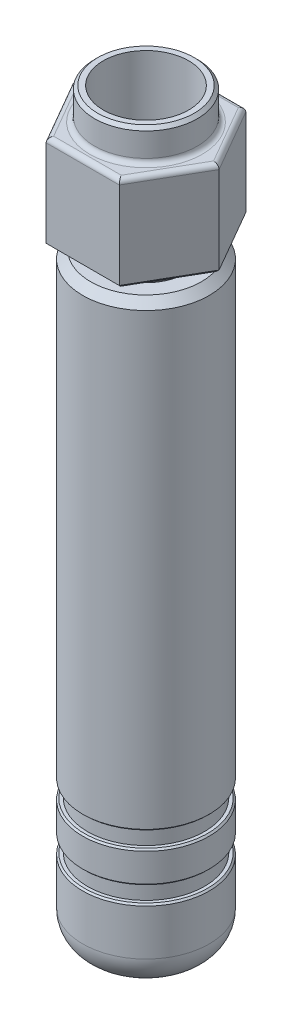
from build123d import *

# Parameters (mm, degrees)
SKETCH_1_R          = 2.85
EXTRUDE_1_DEPTH     = 1
EXTRUDE_2_DEPTH     = 6
SKETCH_3_R          = 3.25
EXTRUDE_3_DEPTH     = 2
CHAMFER_3_SIZE      = 0.2
FILLET_2_R          = 0.3
CHAMFER_4_SIZE      = 0.2
CHAMFER_5_SIZE      = 0.3
SKETCH_5_R          = 2.7
CUT_EXTRUDE_1_DEPTH = 5
SKETCH_6_R          = 4
EXTRUDE_4_DEPTH     = 38
FILLET_3_R          = 2
CHAMFER_6_SIZE      = 0.5
SKETCH_7_W          = 4
SKETCH_7_H          = 1
CHAMFER_7_SIZE      = 0.1


with BuildPart() as part:
    # 草图1 → 凸台-拉伸1 (new body)
    with BuildSketch(Plane(origin=(0, 0, 0), x_dir=(1, 0, 0), z_dir=(0, 1, 0))):
        with Locations(Location((0, 0, 0), (0, 0, 270))):
            Circle(SKETCH_1_R)
    extrude(amount=EXTRUDE_1_DEPTH)

    # 草图2 → 凸台-拉伸2 (add)
    with BuildSketch(Plane(origin=(0, 1, 0), x_dir=(1, 0, 0), z_dir=(0, 1, 0))):
        Polygon((4.618802154, 0), (2.309401077, 4), (-2.309401077, 4), (-4.618802154, 0), (-2.309401077, -4), (2.309401077, -4), align=None)
    extrude(amount=EXTRUDE_2_DEPTH)

    # 草图3 → 凸台-拉伸3 (add)
    with BuildSketch(Plane(origin=(0, 7, 0), x_dir=(1, 0, 0), z_dir=(0, 1, 0))):
        with Locations(Location((0, 0, 0), (0, 0, 270))):
            Circle(SKETCH_3_R)
    extrude(amount=EXTRUDE_3_DEPTH)

    # 倒角3
    chamfer_3_edges = [part.edges().sort_by_distance(p)[0] for p in [
        (0, 1, -2.85),
        (3.464101615, 1, 2),
        (3.464101615, 1, -2),
        (0, 1, -4),
        (-3.464101615, 1, -2),
        (-3.464101615, 1, 2),
        (0, 1, 4),
    ]]
    chamfer(chamfer_3_edges, length=CHAMFER_3_SIZE)

    # 圆角2
    fillet_2_edges = [part.edges().sort_by_distance(p)[0] for p in [
        (0, 7, -3.25),
        (3.464101615, 7, 2),
        (3.464101615, 7, -2),
        (0, 7, -4),
        (-3.464101615, 7, -2),
        (-3.464101615, 7, 2),
        (0, 7, 4),
    ]]
    fillet(fillet_2_edges, radius=FILLET_2_R)

    # 倒角4
    chamfer_4_edges = [part.edges().sort_by_distance(p)[0] for p in [
        (0, 9, -3.25),
    ]]
    chamfer(chamfer_4_edges, length=CHAMFER_4_SIZE)

    # 倒角5
    chamfer_5_edges = [part.edges().sort_by_distance(p)[0] for p in [
        (0, 0, -2.85),
    ]]
    chamfer(chamfer_5_edges, length=CHAMFER_5_SIZE)

    # 草图5 → 切除-拉伸1 (cut)
    with BuildSketch(Plane(origin=(0, 9, 0), x_dir=(1, 0, 0), z_dir=(0, 1, 0))):
        with Locations(Location((0, 0, 0), (0, 0, 270))):
            Circle(SKETCH_5_R)
    extrude(amount=-CUT_EXTRUDE_1_DEPTH, mode=Mode.SUBTRACT)

    # 草图6 → 凸台-拉伸4 (add)
    with BuildSketch(Plane.XZ):
        with Locations(Location((0, 0, 0), (0, 0, 270))):
            Circle(SKETCH_6_R)
    extrude(amount=EXTRUDE_4_DEPTH)

    # 圆角3
    fillet_3_edges = [part.edges().sort_by_distance(p)[0] for p in [
        (0, -38, 4),
    ]]
    fillet(fillet_3_edges, radius=FILLET_3_R)

    # 倒角6
    chamfer_6_edges = [part.edges().sort_by_distance(p)[0] for p in [
        (0, 0, 4),
    ]]
    chamfer(chamfer_6_edges, length=CHAMFER_6_SIZE)

    # 草图7 → 切除-旋转1 (revolve, cut)
    with BuildSketch(Plane(origin=(0, 0, 0), x_dir=(0, 0, -1), z_dir=(1, 0, 0))):
        with Locations((-5.7, -32.5)):
            Rectangle(SKETCH_7_W, SKETCH_7_H)
        with Locations((-5.7, -29.5)):
            Rectangle(SKETCH_7_W, SKETCH_7_H)
    revolve(axis=Axis((0, 0, 0), (0, -1, 0)), mode=Mode.SUBTRACT)

    # 倒角7
    chamfer_7_edges = [part.edges().sort_by_distance(p)[0] for p in [
        (0, -33, 4),
        (0, -32, 4),
        (0, -30, 4),
        (0, -29, 4),
    ]]
    chamfer(chamfer_7_edges, length=CHAMFER_7_SIZE)


solid = part.part
